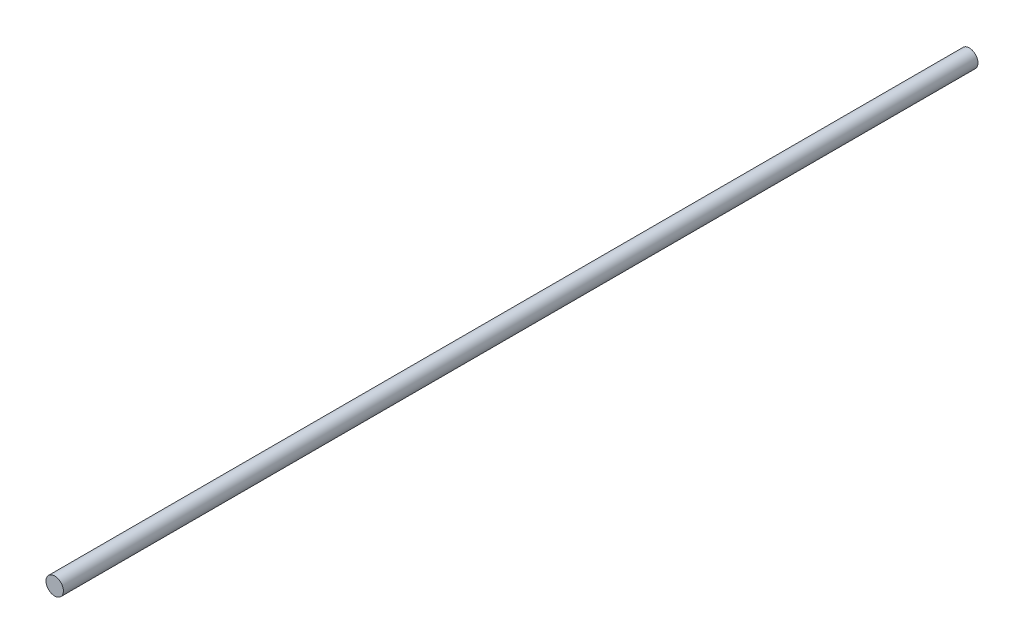
from build123d import *

# Parameters (mm, degrees)
SKETCH1_R           = 20
BOSS_EXTRUDE1_DEPTH = 2100


with BuildPart() as part:
    # Sketch1 → Boss-Extrude1 (new body)
    with BuildSketch(Plane.XY):
        Circle(SKETCH1_R)
    extrude(amount=BOSS_EXTRUDE1_DEPTH)


solid = part.part
